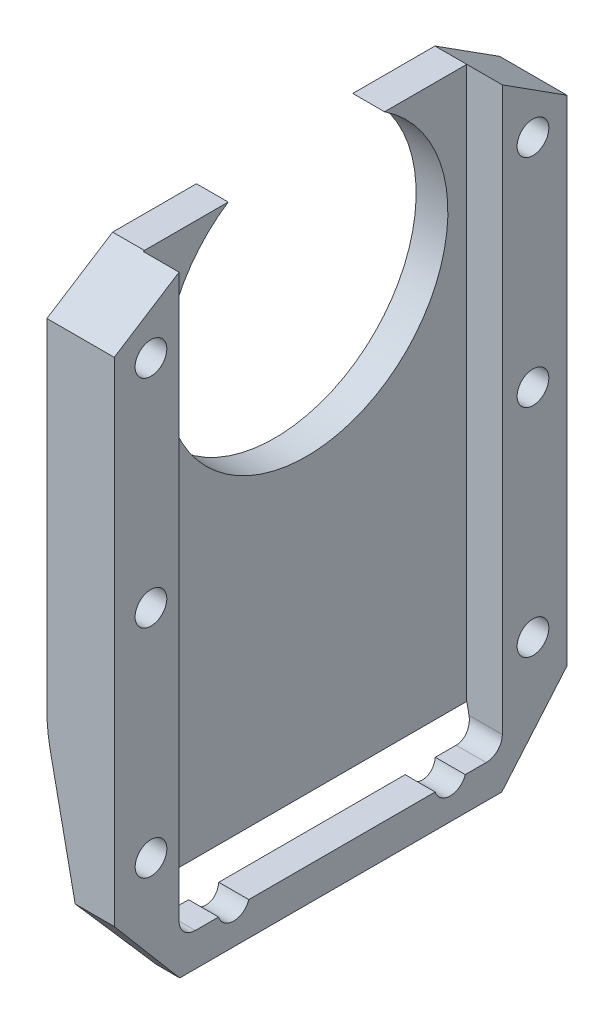
from build123d import *

# Parameters (mm, degrees)
BOSS_EXTRUDE1_DEPTH                   = 35.56
FILLET1_R                             = 12.7
SKETCH6_W                             = 25.384
SKETCH6_H                             = 45.45
CUT_EXTRUDE1_DEPTH                    = 2.794
FILLET2_R                             = 1.27
CUT_EXTRUDE3_DEPTH                    = 61.028856823
CUT_EXTRUDE4_DEPTH                    = 61.028856823
F_7_8_0_875_DIAMETER_HOLE1_D          = 22.225
F_40_0_098_DIAMETER_HOLE1_D           = 2.4892
F_40_0_098_DIAMETER_HOLE1_CSINK_D     = 3.7592
F_40_0_098_DIAMETER_HOLE1_CSINK_ANGLE = 90


with BuildPart() as part:
    # Sketch1 → Boss-Extrude1 (new body)
    with BuildSketch(Plane.XY):
        Polygon((0, 0), (0, 48.072727273), (-5.288, 48.072727273), (-5.288, 16.825454545), (-1.813745922, 0), align=None)
    extrude(amount=BOSS_EXTRUDE1_DEPTH)

    # Fillet1
    fillet1_edges = [part.edges().sort_by_distance(p)[0] for p in [
        (-5.288, 16.825454545, 17.78),
    ]]
    fillet(fillet1_edges, radius=FILLET1_R)

    # Sketch6 → Cut-Extrude1 (cut)
    with BuildSketch(Plane(origin=(0, 0, 0), x_dir=(0, 0, -1), z_dir=(1, 0, 0))):
        with Locations((-17.778, 25.347727273)):
            Rectangle(SKETCH6_W, SKETCH6_H)
    extrude(amount=-CUT_EXTRUDE1_DEPTH, mode=Mode.SUBTRACT)

    # Fillet2
    fillet2_edges = [part.edges().sort_by_distance(p)[0] for p in [
        (-1.177653786, 2.622727273, 30.47),
        (-1.177653786, 2.622727273, 5.086),
    ]]
    fillet(fillet2_edges, radius=FILLET2_R)

    # Sketch10 → Cut-Extrude3 (cut, through all)
    with BuildSketch(Plane(origin=(0, 0, 0), x_dir=(0, 0, -1), z_dir=(1, 0, 0))):
        Polygon((-35.56, 44.780420684), (-30.397580851, 48.072727273), (-35.56, 48.072727273), align=None)
    extrude(amount=-CUT_EXTRUDE3_DEPTH, mode=Mode.SUBTRACT)

    # Sketch11 → Cut-Extrude4 (cut, through all)
    with BuildSketch(Plane(origin=(0, 0, 0), x_dir=(0, 0, -1), z_dir=(1, 0, 0))):
        Polygon((-5.085545117, 48.072727273), (0, 48.072727273), (0, 44.824895363), align=None)
        Polygon((0, 6.029531172), (-5.128692816, 0), (0, 0), align=None)
        Polygon((-35.56, 6.07121688), (-35.56, 0), (-30.417091858, 0), align=None)
    extrude(amount=-CUT_EXTRUDE4_DEPTH, mode=Mode.SUBTRACT)

    # 7/8 (0.875) Diameter Hole1 (through all)
    with Locations(Plane.ZY.offset(5.288)):
        with Locations((17.678535919, 38.809523369)):
            Hole(F_7_8_0_875_DIAMETER_HOLE1_D / 2)

    # #40 (0.098) Diameter Hole1 (through all)
    with Locations(Plane.ZY.offset(5.288)):
        with Locations((2.678535919, 43.309523369), (2.678535919, 26.309523369), (2.678535919, 9.309523369), (9.178535919, 3.009523369), (26.181895158, 2.999179942), (32.672942909, 9.299179942), (32.678535919, 26.309523369), (32.678535919, 43.299179942)):
            CounterSinkHole(F_40_0_098_DIAMETER_HOLE1_D / 2, F_40_0_098_DIAMETER_HOLE1_CSINK_D / 2, counter_sink_angle=F_40_0_098_DIAMETER_HOLE1_CSINK_ANGLE)


solid = part.part
